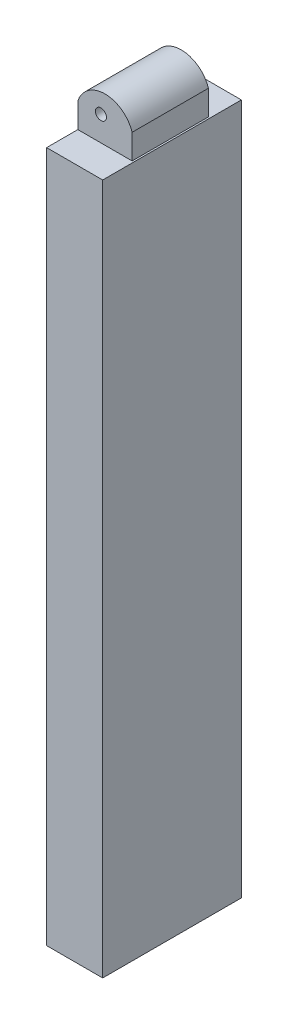
from build123d import *

# Parameters (mm, degrees)
SKETCH1_W           = 119.6
SKETCH1_H           = 24
BOSS_EXTRUDE1_DEPTH = 9.7
SKETCH3_W           = 9.4
SKETCH3_H           = 13.2
BOSS_EXTRUDE2_DEPTH = 8
SKETCH4_R           = 0.95
CUT_EXTRUDE1_DEPTH  = 71.971050436


with BuildPart() as part:
    # Sketch1 → Boss-Extrude1 (new body)
    with BuildSketch(Plane.YZ):
        Rectangle(SKETCH1_W, SKETCH1_H)
    extrude(amount=BOSS_EXTRUDE1_DEPTH)

    # Sketch3 → Boss-Extrude2 (add)
    with BuildSketch(Plane(origin=(0, 59.8, 0), x_dir=(-1, 0, 0), z_dir=(0, 1, 0))):
        with Locations((-4.7, 0)):
            Rectangle(SKETCH3_W, SKETCH3_H)
    extrude(amount=BOSS_EXTRUDE2_DEPTH)

    # Sketch4 → Cut-Extrude1 (cut, through all)
    with BuildSketch(Plane.XY.offset(6.6)):
        with BuildLine():
            Line((0, 67.8), (0, 64.1))
            ThreePointArc((0, 64.1), (4.7, 67.5), (9.4, 64.1))
            Line((9.4, 64.1), (9.4, 67.8))
            Line((9.4, 67.8), (0, 67.8))
        make_face()
        with Locations((4, 64.1)):
            Circle(SKETCH4_R)
    extrude(amount=-CUT_EXTRUDE1_DEPTH, mode=Mode.SUBTRACT)


solid = part.part
